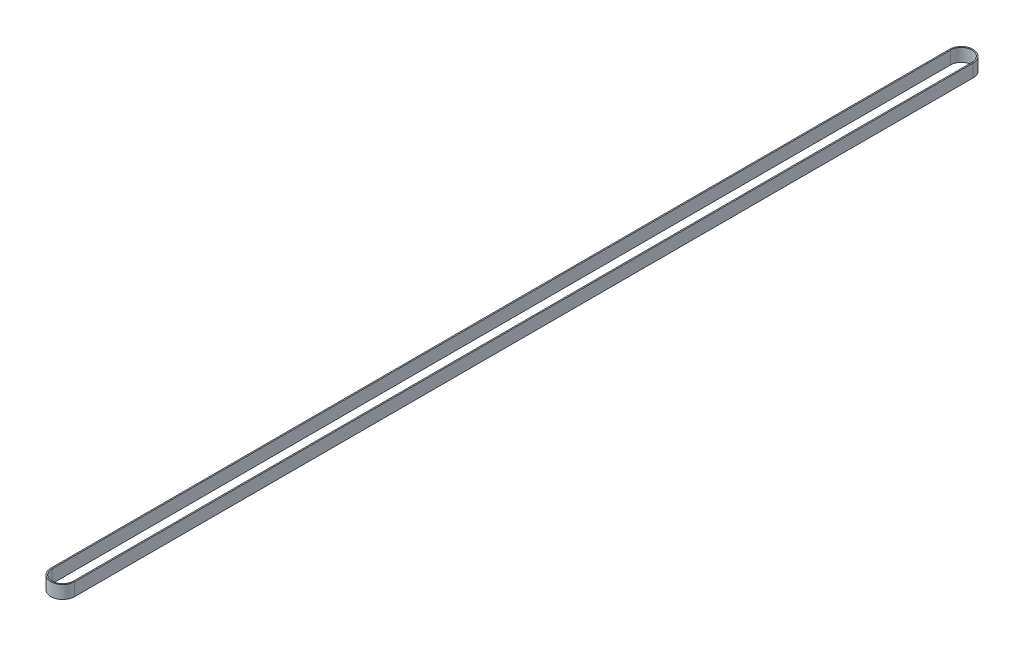
from build123d import *

# Parameters (mm, degrees)
BOSS_EXTRUDE1_DEPTH = 11


with BuildPart() as part:
    # Sketch1 → Boss-Extrude1 (new body)
    with BuildSketch(Plane(origin=(0, 0, 0), x_dir=(1, 0, 0), z_dir=(0, 1, 0))):
        with BuildLine():
            Line((-10.05, 400), (-10.05, -362.5))
            ThreePointArc((-10.05, -362.5), (0, -372.55), (10.05, -362.5))
            Line((10.05, -362.5), (10.05, 400))
            ThreePointArc((10.05, 400), (0, 410.05), (-10.05, 400))
        make_face()
        with BuildLine():
            Line((-9.05, 400), (-9.05, -362.5))
            ThreePointArc((-9.05, -362.5), (0, -371.55), (9.05, -362.5))
            Line((9.05, -362.5), (9.05, 400))
            ThreePointArc((9.05, 400), (0, 409.05), (-9.05, 400))
        make_face(mode=Mode.SUBTRACT)
    extrude(amount=BOSS_EXTRUDE1_DEPTH)


solid = part.part
